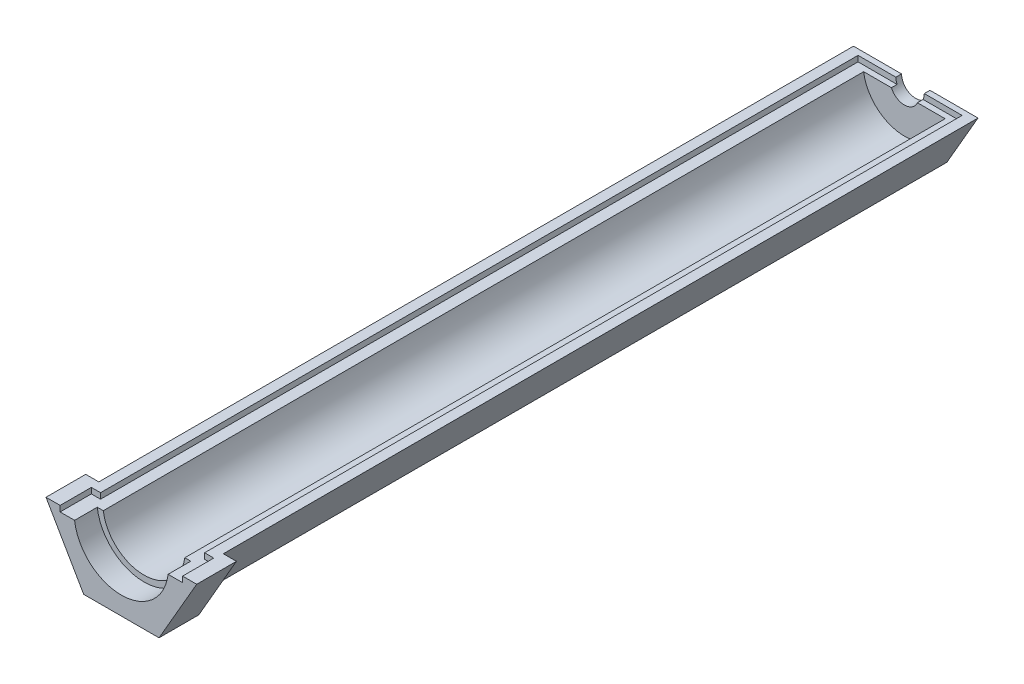
from build123d import *

# Parameters (mm, degrees)
AUFSATZ_LINEAR_AUSTRAGEN1_DEPTH = 136
AUFSATZ_LINEAR_AUSTRAGEN2_DEPTH = 2
AUFSATZ_LINEAR_AUSTRAGEN3_DEPTH = 7
SCHNITT_LINEAR_AUSTRAGEN2_DEPTH = 1
SCHNITT_LINEAR_AUSTRAGEN1_REACH = 143.098
SKIZZE14_R                      = 2.5


with BuildPart() as part:
    # Skizze1 → Aufsatz-Linear austragen1 (new body)
    with BuildSketch(Plane.XY):
        with BuildLine():
            Line((7.25, 0), (10.969655115, 0))
            Line((10.969655115, 0), (5.484827557, -9.5))
            Line((5.484827557, -9.5), (-5.484827557, -9.5))
            Line((-5.484827557, -9.5), (-10.969655115, 0))
            Line((-10.969655115, 0), (-7.25, 0))
            ThreePointArc((-7.25, 0), (0, -7.25), (7.25, 0))
        make_face()
    extrude(amount=AUFSATZ_LINEAR_AUSTRAGEN1_DEPTH)

    # Skizze2 → Aufsatz-Linear austragen2 (add)
    with BuildSketch(Plane.XY):
        with BuildLine():
            Line((7.25, 0), (-7.25, 0))
            ThreePointArc((-7.25, 0), (0, -7.25), (7.25, 0))
        make_face()
    extrude(amount=AUFSATZ_LINEAR_AUSTRAGEN2_DEPTH)

    # Skizze3 → Aufsatz-Linear austragen3 (add)
    with BuildSketch(Plane.XY.offset(133)):
        with BuildLine():
            Line((-8.3, 0), (-13.279056191, 0))
            Line((-13.279056191, 0), (-6.639528096, -11.5))
            Line((-6.639528096, -11.5), (6.639528096, -11.5))
            Line((6.639528096, -11.5), (13.279056191, 0))
            Line((13.279056191, 0), (8.3, 0))
            ThreePointArc((8.3, 0), (0, -8.3), (-8.3, 0))
        make_face()
    extrude(amount=AUFSATZ_LINEAR_AUSTRAGEN3_DEPTH)

    # Skizze13 → Schnitt-Linear austragen2 (cut)
    with BuildSketch(Plane(origin=(0, 0, 0), x_dir=(1, 0, 0), z_dir=(0, 1, 0))):
        Polygon((-10.789528096, -140), (10.789528096, -140), (10.789528096, -134.5), (9.169655115, -134.5), (9.169655115, -1), (-9.169655115, -1), (-9.169655115, -134.5), (-10.789528096, -134.5), align=None)
    extrude(amount=-SCHNITT_LINEAR_AUSTRAGEN2_DEPTH, mode=Mode.SUBTRACT)

    # Schnitt-Linear austragen1: up to this face of the body (flat: up to its plane)
    schnitt_linear_austragen1_end = Plane(part.part.faces().sort_by_distance((0, -3.624030572, 2))[0])
    # Skizze14 → Schnitt-Linear austragen1 (cut, up to the picked face)
    with BuildSketch(Plane(origin=(0, 0, 0), x_dir=(-1, 0, 0), z_dir=(0, 0, -1)), mode=Mode.PRIVATE) as schnitt_linear_austragen1_sk1:
        Circle(SKIZZE14_R)
    schnitt_linear_austragen1_tool1 = split(extrude(schnitt_linear_austragen1_sk1.sketch, amount=-SCHNITT_LINEAR_AUSTRAGEN1_REACH, mode=Mode.PRIVATE), bisect_by=schnitt_linear_austragen1_end, keep=Keep.BOTH, mode=Mode.PRIVATE)
    add(schnitt_linear_austragen1_tool1.solids().sort_by(Axis((0, 0, 0), (0, 0, 1)))[0], mode=Mode.SUBTRACT)


solid = part.part
